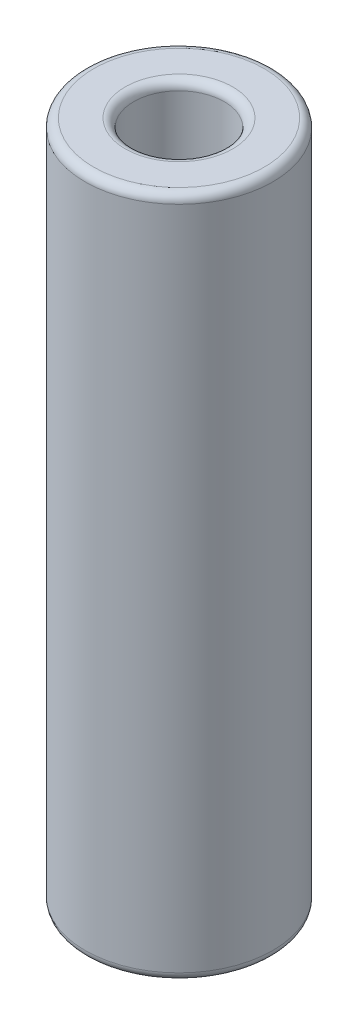
from build123d import *

# Parameters (mm, degrees)
ESBO_O1_R                = 5.5
RESSALTO_EXTRUS_O1_DEPTH = 40
ESBO_O2_R                = 2.65
CORTE_EXTRUS_O1_DEPTH    = 40
FILETE1_R                = 0.5
FILETE2_R                = 0.5


with BuildPart() as part:
    # Esboço1 → Ressalto-extrusão1 (new body)
    with BuildSketch(Plane(origin=(0, 0, 0), x_dir=(1, 0, 0), z_dir=(0, 1, 0))):
        with Locations(Location((0, 0, 0), (0, 0, 270))):
            Circle(ESBO_O1_R)
    extrude(amount=RESSALTO_EXTRUS_O1_DEPTH)

    # Esboço2 → Corte-extrusão1 (cut)
    with BuildSketch(Plane(origin=(0, 40, 0), x_dir=(1, 0, 0), z_dir=(0, 1, 0))):
        with Locations(Location((0, 0, 0), (0, 0, 270))):
            Circle(ESBO_O2_R)
    extrude(amount=-CORTE_EXTRUS_O1_DEPTH, mode=Mode.SUBTRACT)

    # Filete1
    filete1_edges = [part.edges().sort_by_distance(p)[0] for p in [
        (0, 0, -5.5),
        (0, 40, -5.5),
    ]]
    fillet(filete1_edges, radius=FILETE1_R)

    # Filete2
    filete2_edges = [part.edges().sort_by_distance(p)[0] for p in [
        (0, 0, -2.65),
        (0, 40, -2.65),
    ]]
    fillet(filete2_edges, radius=FILETE2_R)


solid = part.part
